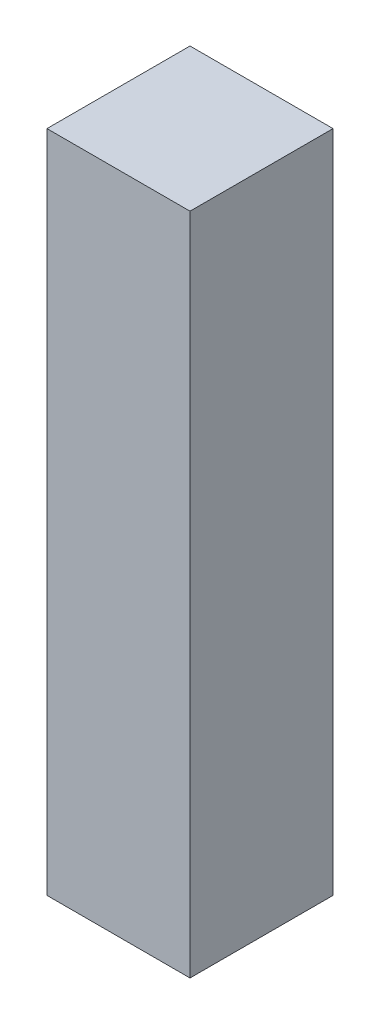
from build123d import *

# Parameters (mm, degrees)
CROQUIS1_W              = 7
CROQUIS1_H              = 7
SALIENTE_EXTRUIR1_DEPTH = 16.25


with BuildPart() as part:
    # Croquis1 → Saliente-Extruir1 (new, symmetric)
    with BuildSketch(Plane(origin=(0, 0, 0), x_dir=(1, 0, 0), z_dir=(0, 1, 0))):
        Rectangle(CROQUIS1_W, CROQUIS1_H)
    extrude(amount=SALIENTE_EXTRUIR1_DEPTH, both=True)


solid = part.part
